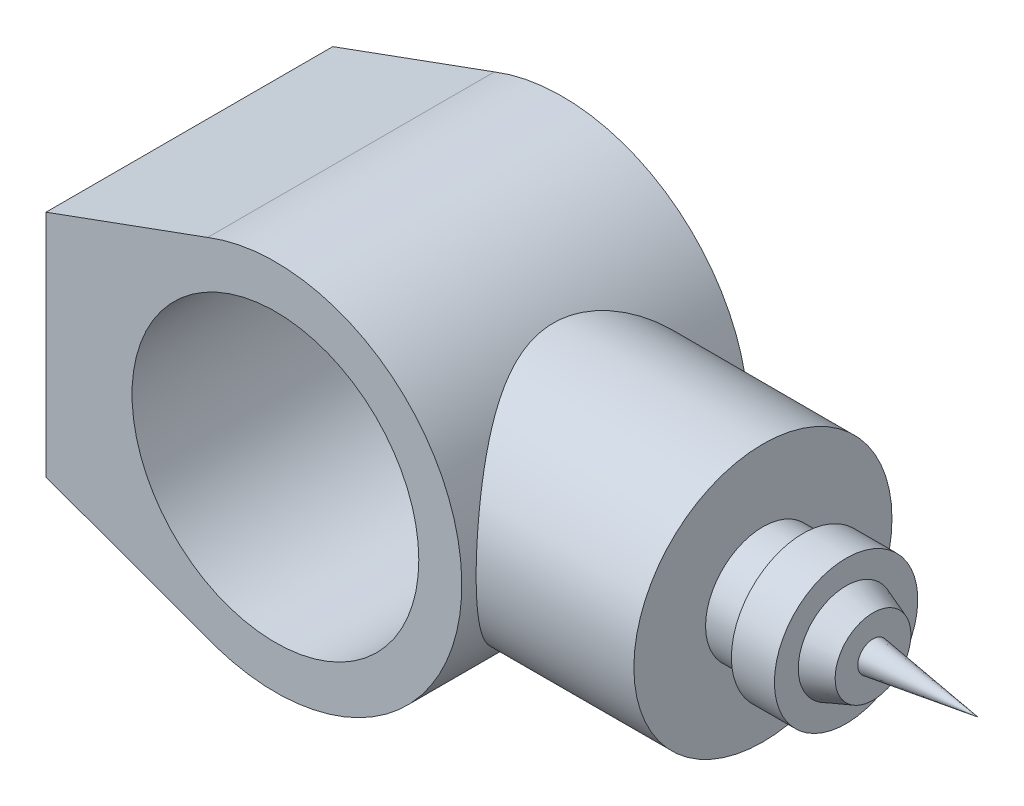
from build123d import *

# Parameters (mm, degrees)
SKETCH1_R                = 50
BOSS_EXTRUDE1_DEPTH      = 50
BOSS_EXTRUDE2_REACH      = 218.16
BOSS_EXTRUDE2_END_RADIUS = 65
SKETCH3_R                = 45


with BuildPart() as part:
    # Sketch1 → Boss-Extrude1 (new, symmetric)
    with BuildSketch(Plane.XY):
        with BuildLine():
            Line((-80, -40), (-80, 40))
            Line((-80, 40), (-23.631612274, 60.552018144))
            ThreePointArc((-23.631612274, 60.552018144), (64.978074331, 1.688151706), (-20.45553182, -61.697416623))
            Line((-20.45553182, -61.697416623), (-80, -40))
        make_face()
        Circle(SKETCH1_R, mode=Mode.SUBTRACT)
    extrude(amount=BOSS_EXTRUDE1_DEPTH, both=True)

    # Boss-Extrude2: up to this cylinder (the profile starts outside it)
    boss_extrude2_end = Plane(origin=(0, 0, 0), z_dir=(0, 0, -1)) * Cylinder(BOSS_EXTRUDE2_END_RADIUS, 567.32, mode=Mode.PRIVATE)
    # Sketch3 → Boss-Extrude2 (add, up to the surface)
    with BuildSketch(Plane.ZY.offset(-120), mode=Mode.PRIVATE) as boss_extrude2_sk1:
        with Locations(Location((0, 0, 0), (0, 0, 180))):
            Circle(SKETCH3_R)
    boss_extrude2_tool1 = extrude(boss_extrude2_sk1.sketch, amount=BOSS_EXTRUDE2_REACH, mode=Mode.PRIVATE) - boss_extrude2_end
    add(boss_extrude2_tool1.solids().sort_by_distance((120, 0, 0))[0])

    # Sketch4 → Revolve1 (revolve)
    with BuildSketch(Plane.XY, mode=Mode.PRIVATE) as revolve1_sk:
        Polygon((120, 0), (195, 0), (158.381829475, -5.301847546), (158.381829475, -13.205820305), (149, -16.667218245), (149, -25), (134, -25), (134, -20), (120, -20), align=None)
    revolve(revolve1_sk.sketch.rotate(Axis((120, 0, 0), (1, 0, 0)), 270), axis=Axis((120, 0, 0), (1, 0, 0)))


solid = part.part
